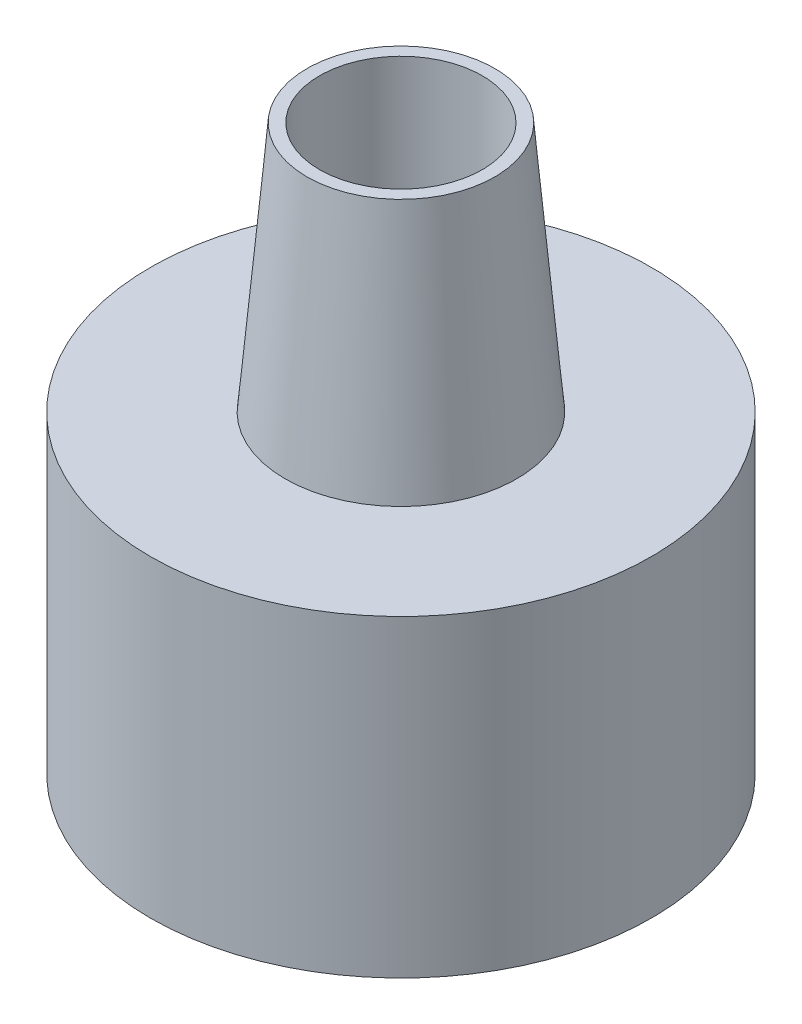
from build123d import *


with BuildPart() as part:
    # Sketch1 → Revolve1 (revolve)
    with BuildSketch(Plane(origin=(0, 0, 0), x_dir=(0, 0, -1), z_dir=(1, 0, 0))):
        Polygon((-6, 3.75), (-6, -4.25), (-8, -6.25), (-10, -6.25), (-10, 6.25), (-4.624886635, 6.25), (-3.75, 16.25), (-3.25, 16.25), (-3.25, 3.75), align=None)
    revolve(axis=Axis((0, 15.090909091, 0), (0, -1, 0)))


solid = part.part
